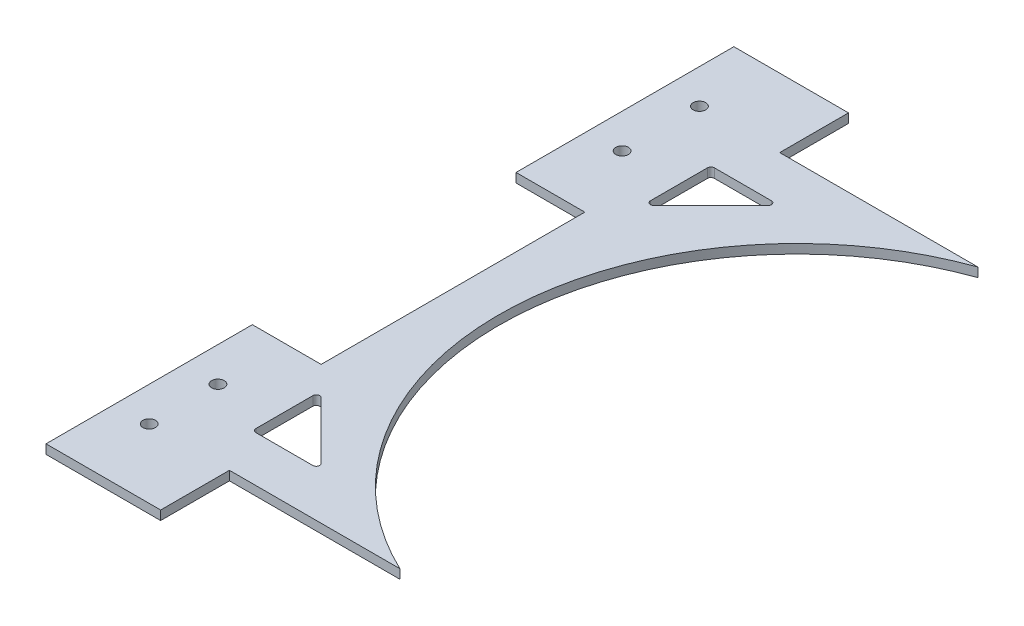
from build123d import *

# Parameters (mm, degrees)
SKETCH_1_W          = 360
SKETCH_1_H          = 300
EXTRUDE_1_DEPTH     = 4
SKETCH_2_W          = 260
SKETCH_2_H          = 30
CUT_EXTRUDE_1_DEPTH = 469.632051827
SKETCH_3_W          = 30
SKETCH_3_H          = 115
CUT_EXTRUDE_2_DEPTH = 469.632051827
CUT_EXTRUDE_3_DEPTH = 469.632051827
CUT_EXTRUDE_4_DEPTH = 330.611201771
CUT_EXTRUDE_5_DEPTH = 330.611201771


with BuildPart() as part:
    # 草图1 → 凸台-拉伸1 (new body)
    with BuildSketch(Plane(origin=(0, 0, 0), x_dir=(1, 0, 0), z_dir=(0, 1, 0))):
        with Locations((180, -150)):
            Rectangle(SKETCH_1_W, SKETCH_1_H)
    extrude(amount=EXTRUDE_1_DEPTH)

    # 草图2 → 切除-拉伸1 (cut, through all)
    with BuildSketch(Plane(origin=(0, 4, 0), x_dir=(1, 0, 0), z_dir=(0, 1, 0))):
        with Locations((180, -15)):
            Rectangle(SKETCH_2_W, SKETCH_2_H)
        Polygon((310, -270), (50, -270), (50, -300), (310, -300), (310, -297.414750004), align=None)
    extrude(amount=-CUT_EXTRUDE_1_DEPTH, mode=Mode.SUBTRACT)

    # 草图3 → 切除-拉伸2 (cut, through all)
    with BuildSketch(Plane(origin=(0, 4, 0), x_dir=(1, 0, 0), z_dir=(0, 1, 0))):
        with Locations((15, -152.5)):
            Rectangle(SKETCH_3_W, SKETCH_3_H)
        with Locations((345, -152.5)):
            Rectangle(SKETCH_3_W, SKETCH_3_H)
    extrude(amount=-CUT_EXTRUDE_2_DEPTH, mode=Mode.SUBTRACT)

    # 草图4 → 切除-拉伸3 (cut, through all)
    with BuildSketch(Plane(origin=(0, 4, 0), x_dir=(1, 0, 0), z_dir=(0, 1, 0))):
        with BuildLine():
            ThreePointArc((136.482762036, -30), (73.799150344, -77.524140336), (50, -152.5))
            Line((50, -152.5), (180, -152.5))
            Line((180, -152.5), (180, -30))
            Line((180, -30), (136.482762036, -30))
        make_face()
        with BuildLine():
            Line((180, -30), (180, -152.5))
            Line((180, -152.5), (310, -152.5))
            ThreePointArc((310, -152.5), (286.200849656, -77.524140336), (223.517237964, -30))
            Line((223.517237964, -30), (180, -30))
        make_face()
        with BuildLine():
            Line((180, -152.5), (50, -152.5))
            ThreePointArc((50, -152.5), (70.157400056, -222.031311203), (124.378511347, -270))
            Line((124.378511347, -270), (180, -270))
            Line((180, -270), (180, -152.5))
        make_face()
        with BuildLine():
            Line((310, -152.5), (180, -152.5))
            Line((180, -152.5), (180, -270))
            Line((180, -270), (235.621488653, -270))
            ThreePointArc((235.621488653, -270), (289.842599944, -222.031311203), (310, -152.5))
        make_face()
    extrude(amount=-CUT_EXTRUDE_3_DEPTH, mode=Mode.SUBTRACT)


with BuildPart() as cut_extrude_3_kept_piece:
    # of the separate pieces the step leaves, the one the design keeps (cut_extrude_3_pieces_kept)
    add(part.part.solids().sort_by_distance((0, 0, 0))[0])

    # 草图5 → 切除-拉伸4 (cut, through all)
    with BuildSketch(Plane(origin=(0, 4, 0), x_dir=(1, 0, 0), z_dir=(0, 1, 0))):
        with BuildLine():
            ThreePointArc((15, -27.25), (12.25, -30), (15, -32.75))
            Line((15, -32.75), (15, -30))
            Line((15, -30), (15, -27.25))
        make_face()
        with BuildLine():
            Line((15, -30), (15, -32.75))
            ThreePointArc((15, -32.75), (16.944543648, -31.944543648), (17.75, -30))
            ThreePointArc((17.75, -30), (16.944543648, -28.055456352), (15, -27.25))
            Line((15, -27.25), (15, -30))
        make_face()
        with BuildLine():
            ThreePointArc((15, -60.994001195), (12.25, -63.744001195), (15, -66.494001195))
            Line((15, -66.494001195), (15, -63.744001195))
            Line((15, -63.744001195), (15, -60.994001195))
        make_face()
        with BuildLine():
            Line((15, -63.744001195), (15, -66.494001195))
            ThreePointArc((15, -66.494001195), (16.944543648, -65.688544844), (17.75, -63.744001195))
            ThreePointArc((17.75, -63.744001195), (16.944543648, -61.799457547), (15, -60.994001195))
            Line((15, -60.994001195), (15, -63.744001195))
        make_face()
        with BuildLine():
            ThreePointArc((15, -237.25), (12.25, -240), (15, -242.75))
            Line((15, -242.75), (15, -240))
            Line((15, -240), (15, -237.25))
        make_face()
        with BuildLine():
            Line((15, -240), (15, -242.75))
            ThreePointArc((15, -242.75), (16.944543648, -241.944543648), (17.75, -240))
            ThreePointArc((17.75, -240), (16.944543648, -238.055456352), (15, -237.25))
            Line((15, -237.25), (15, -240))
        make_face()
        with BuildLine():
            ThreePointArc((15, -267.25), (12.25, -270), (15, -272.75))
            Line((15, -272.75), (15, -270))
            Line((15, -270), (15, -267.25))
        make_face()
        with BuildLine():
            Line((15, -270), (15, -272.75))
            ThreePointArc((15, -272.75), (16.944543648, -271.944543648), (17.75, -270))
            ThreePointArc((17.75, -270), (16.944543648, -268.055456352), (15, -267.25))
            Line((15, -267.25), (15, -270))
        make_face()
    extrude(amount=-CUT_EXTRUDE_4_DEPTH, mode=Mode.SUBTRACT)

    # 草图6 → 切除-拉伸5 (cut, through all)
    with BuildSketch(Plane(origin=(0, 4, 0), x_dir=(1, 0, 0), z_dir=(0, 1, 0))):
        with BuildLine():
            Line((50, -50), (66.378679656, -50))
            ThreePointArc((66.378679656, -50), (67.764498955, -50.925974851), (67.439339828, -52.560660172))
            Line((67.439339828, -52.560660172), (42.560660172, -77.439339828))
            ThreePointArc((42.560660172, -77.439339828), (40.925974851, -77.764498955), (40, -76.378679656))
            Line((40, -76.378679656), (40, -51.5))
            ThreePointArc((40, -51.5), (40.439339828, -50.439339828), (41.5, -50))
            Line((41.5, -50), (50, -50))
        make_face()
    cut_extrude_5 = extrude(amount=-CUT_EXTRUDE_5_DEPTH, mode=Mode.SUBTRACT)

    # 镜向1: 切除-拉伸5 across plane
    add(cut_extrude_5.mirror(Plane.XY.offset(150)), mode=Mode.SUBTRACT)


solid = cut_extrude_3_kept_piece.part
